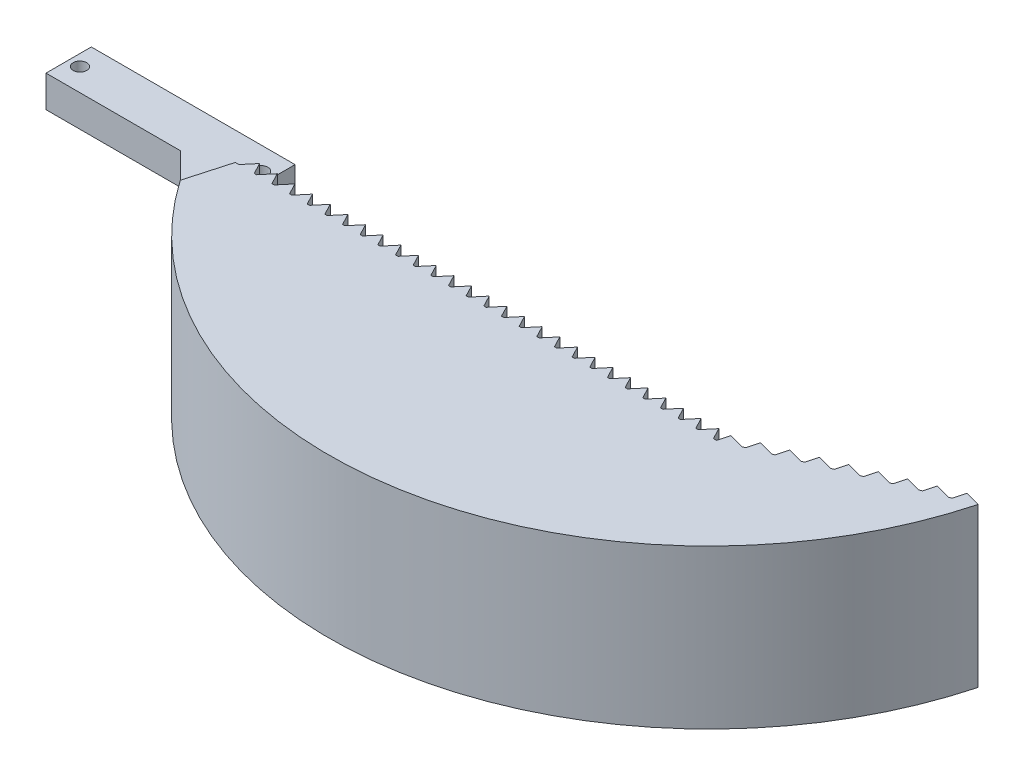
from build123d import *

# Parameters (mm, degrees)
SKETCH1_W           = 45
SKETCH1_H           = 10
BOSS_EXTRUDE1_DEPTH = 7
SKETCH2_R           = 1.5
CUT_EXTRUDE1_DEPTH  = 15
BOSS_EXTRUDE2_DEPTH = 7
BOSS_EXTRUDE3_DEPTH = 17.5


with BuildPart() as part:
    # Sketch1 → Boss-Extrude1 (new body)
    with BuildSketch(Plane(origin=(0, 0, 0), x_dir=(1, 0, 0), z_dir=(0, 1, 0))):
        Rectangle(SKETCH1_W, SKETCH1_H)
    extrude(amount=BOSS_EXTRUDE1_DEPTH)

    # Sketch2 → Cut-Extrude1 (cut)
    with BuildSketch(Plane(origin=(0, 7, 0), x_dir=(1, 0, 0), z_dir=(0, 1, 0))):
        with Locations((-20, 0)):
            Circle(SKETCH2_R)
        with Locations((20, 0)):
            Circle(SKETCH2_R)
    extrude(amount=-CUT_EXTRUDE1_DEPTH, mode=Mode.SUBTRACT)

    # Sketch5 → Boss-Extrude2 (add)
    with BuildSketch(Plane(origin=(0, 7, 0), x_dir=(1, 0, 0), z_dir=(0, 1, 0))):
        Polygon((19.2999618, -5), (32.988821569, -18.688859769), (30.31750473, -28.162976429), (7.154528301, -5), align=None)
    extrude(amount=-BOSS_EXTRUDE2_DEPTH)

    # Sketch5<6> → Boss-Extrude3 (add, symmetric)
    with BuildSketch(Plane(origin=(0, 7, 0), x_dir=(1, 0, 0), z_dir=(0, 1, 0))):
        with BuildLine():
            Line((33.794492956, -18.688859769), (32.988821569, -18.688859769))
            Line((32.988821569, -18.688859769), (30.31750473, -28.162976429))
            ThreePointArc((30.31750473, -28.162976429), (113.686282102, -63.078391798), (180.395979402, -2.092692187))
            Line((180.395979402, -2.092692187), (177.016273904, -1.1878774))
            Line((177.016273904, -1.1878774), (176.333417559, -3.738513594))
            Line((176.333417559, -3.738513594), (175.761821244, -3.970078181))
            Line((175.761821244, -3.970078181), (172.382115747, -3.065263394))
            Line((172.382115747, -3.065263394), (171.699259402, -5.615899588))
            Line((171.699259402, -5.615899588), (171.127663087, -5.847464174))
            Line((171.127663087, -5.847464174), (167.747957589, -4.942649388))
            Line((167.747957589, -4.942649388), (167.065101244, -7.493285582))
            Line((167.065101244, -7.493285582), (166.493504929, -7.724850168))
            Line((166.493504929, -7.724850168), (163.113799431, -6.820035382))
            Line((163.113799431, -6.820035382), (162.430943086, -9.370671576))
            Line((162.430943086, -9.370671576), (161.859346771, -9.602236162))
            Line((161.859346771, -9.602236162), (158.479641274, -8.697421376))
            Line((158.479641274, -8.697421376), (157.796784929, -11.24805757))
            Line((157.796784929, -11.24805757), (157.225188614, -11.479622156))
            Line((157.225188614, -11.479622156), (153.845483116, -10.57480737))
            Line((153.845483116, -10.57480737), (153.162626771, -13.125443564))
            Line((153.162626771, -13.125443564), (152.591030456, -13.35700815))
            Line((152.591030456, -13.35700815), (149.211324958, -12.452193363))
            Line((149.211324958, -12.452193363), (148.528468613, -15.002829558))
            Line((148.528468613, -15.002829558), (147.956872298, -15.234394144))
            Line((147.956872298, -15.234394144), (144.577166801, -14.329579357))
            Line((144.577166801, -14.329579357), (143.894310456, -16.880215552))
            Line((143.894310456, -16.880215552), (143.322714141, -17.111780138))
            Line((143.322714141, -17.111780138), (139.943008643, -16.206965351))
            Line((139.943008643, -16.206965351), (139.278555847, -18.688859769))
            Line((139.278555847, -18.688859769), (138.569191128, -18.688859769))
            Line((138.569191128, -18.688859769), (137.277695253, -16.206965351))
            Line((137.277695253, -16.206965351), (135.194492956, -18.688859769))
            Line((135.194492956, -18.688859769), (134.669191128, -18.688859769))
            Line((134.669191128, -18.688859769), (133.377695253, -16.206965351))
            Line((133.377695253, -16.206965351), (131.294492956, -18.688859769))
            Line((131.294492956, -18.688859769), (130.769191128, -18.688859769))
            Line((130.769191128, -18.688859769), (129.477695253, -16.206965351))
            Line((129.477695253, -16.206965351), (127.394492956, -18.688859769))
            Line((127.394492956, -18.688859769), (126.869191128, -18.688859769))
            Line((126.869191128, -18.688859769), (125.577695253, -16.206965351))
            Line((125.577695253, -16.206965351), (123.494492956, -18.688859769))
            Line((123.494492956, -18.688859769), (122.969191128, -18.688859769))
            Line((122.969191128, -18.688859769), (121.677695253, -16.206965351))
            Line((121.677695253, -16.206965351), (119.594492956, -18.688859769))
            Line((119.594492956, -18.688859769), (119.069191128, -18.688859769))
            Line((119.069191128, -18.688859769), (117.777695253, -16.206965351))
            Line((117.777695253, -16.206965351), (115.694492956, -18.688859769))
            Line((115.694492956, -18.688859769), (115.169191128, -18.688859769))
            Line((115.169191128, -18.688859769), (113.877695253, -16.206965351))
            Line((113.877695253, -16.206965351), (111.794492956, -18.688859769))
            Line((111.794492956, -18.688859769), (111.269191128, -18.688859769))
            Line((111.269191128, -18.688859769), (109.977695253, -16.206965351))
            Line((109.977695253, -16.206965351), (107.894492956, -18.688859769))
            Line((107.894492956, -18.688859769), (107.369191128, -18.688859769))
            Line((107.369191128, -18.688859769), (106.077695253, -16.206965351))
            Line((106.077695253, -16.206965351), (103.994492956, -18.688859769))
            Line((103.994492956, -18.688859769), (103.469191128, -18.688859769))
            Line((103.469191128, -18.688859769), (102.177695253, -16.206965351))
            Line((102.177695253, -16.206965351), (100.094492956, -18.688859769))
            Line((100.094492956, -18.688859769), (99.569191128, -18.688859769))
            Line((99.569191128, -18.688859769), (98.277695253, -16.206965351))
            Line((98.277695253, -16.206965351), (96.194492956, -18.688859769))
            Line((96.194492956, -18.688859769), (95.669191128, -18.688859769))
            Line((95.669191128, -18.688859769), (94.377695253, -16.206965351))
            Line((94.377695253, -16.206965351), (92.294492956, -18.688859769))
            Line((92.294492956, -18.688859769), (91.769191128, -18.688859769))
            Line((91.769191128, -18.688859769), (90.477695253, -16.206965351))
            Line((90.477695253, -16.206965351), (88.394492956, -18.688859769))
            Line((88.394492956, -18.688859769), (87.869191128, -18.688859769))
            Line((87.869191128, -18.688859769), (86.577695253, -16.206965351))
            Line((86.577695253, -16.206965351), (84.494492956, -18.688859769))
            Line((84.494492956, -18.688859769), (83.969191128, -18.688859769))
            Line((83.969191128, -18.688859769), (82.677695253, -16.206965351))
            Line((82.677695253, -16.206965351), (80.594492956, -18.688859769))
            Line((80.594492956, -18.688859769), (80.069191128, -18.688859769))
            Line((80.069191128, -18.688859769), (78.777695253, -16.206965351))
            Line((78.777695253, -16.206965351), (76.694492956, -18.688859769))
            Line((76.694492956, -18.688859769), (76.169191128, -18.688859769))
            Line((76.169191128, -18.688859769), (74.877695253, -16.206965351))
            Line((74.877695253, -16.206965351), (72.794492956, -18.688859769))
            Line((72.794492956, -18.688859769), (72.269191128, -18.688859769))
            Line((72.269191128, -18.688859769), (70.977695253, -16.206965351))
            Line((70.977695253, -16.206965351), (68.894492956, -18.688859769))
            Line((68.894492956, -18.688859769), (68.369191128, -18.688859769))
            Line((68.369191128, -18.688859769), (67.077695253, -16.206965351))
            Line((67.077695253, -16.206965351), (64.994492956, -18.688859769))
            Line((64.994492956, -18.688859769), (64.469191128, -18.688859769))
            Line((64.469191128, -18.688859769), (63.177695253, -16.206965351))
            Line((63.177695253, -16.206965351), (61.094492956, -18.688859769))
            Line((61.094492956, -18.688859769), (60.569191128, -18.688859769))
            Line((60.569191128, -18.688859769), (59.277695253, -16.206965351))
            Line((59.277695253, -16.206965351), (57.194492956, -18.688859769))
            Line((57.194492956, -18.688859769), (56.669191128, -18.688859769))
            Line((56.669191128, -18.688859769), (55.377695253, -16.206965351))
            Line((55.377695253, -16.206965351), (53.294492956, -18.688859769))
            Line((53.294492956, -18.688859769), (52.769191128, -18.688859769))
            Line((52.769191128, -18.688859769), (51.477695253, -16.206965351))
            Line((51.477695253, -16.206965351), (49.394492956, -18.688859769))
            Line((49.394492956, -18.688859769), (48.869191128, -18.688859769))
            Line((48.869191128, -18.688859769), (47.577695253, -16.206965351))
            Line((47.577695253, -16.206965351), (45.494492956, -18.688859769))
            Line((45.494492956, -18.688859769), (44.969191128, -18.688859769))
            Line((44.969191128, -18.688859769), (43.677695253, -16.206965351))
            Line((43.677695253, -16.206965351), (41.594492956, -18.688859769))
            Line((41.594492956, -18.688859769), (41.069191128, -18.688859769))
            Line((41.069191128, -18.688859769), (39.777695253, -16.206965351))
            Line((39.777695253, -16.206965351), (37.694492956, -18.688859769))
            Line((37.694492956, -18.688859769), (37.169191128, -18.688859769))
            Line((37.169191128, -18.688859769), (35.877695253, -16.206965351))
            Line((35.877695253, -16.206965351), (33.794492956, -18.688859769))
        make_face()
    extrude(amount=BOSS_EXTRUDE3_DEPTH, both=True)


solid = part.part
